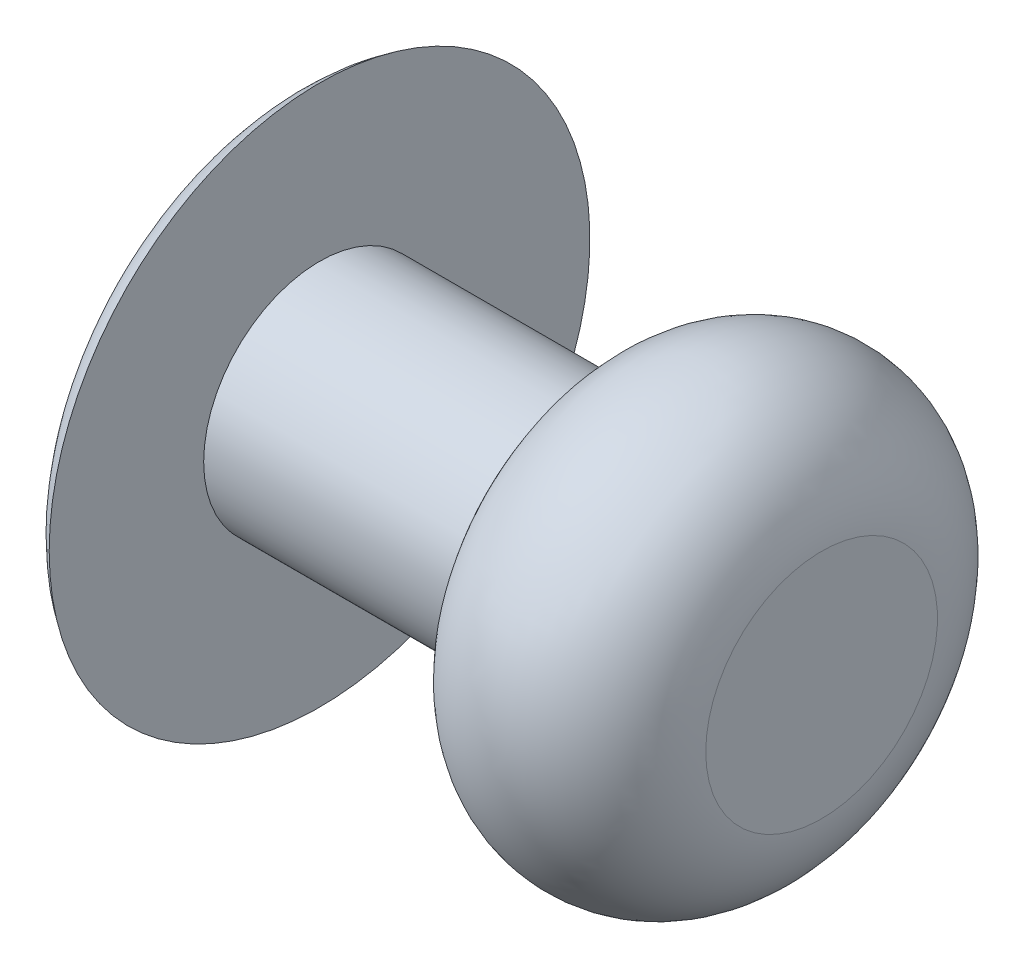
from build123d import *

# Parameters (mm, degrees)
ESQUISSE2_R      = 1
EXTRUSION1_DEPTH = 4


with BuildPart() as part:
    # Esquisse1 → Révolution1 (revolve)
    with BuildSketch(Plane.XY, mode=Mode.PRIVATE) as r_volution1_sk:
        with BuildLine():
            Line((-13.490599357, 0), (-13.490599357, 2.5))
            ThreePointArc((-13.490599357, 2.5), (-13.343527434, 3.071044042), (-12.938906334, 3.5))
            Line((-12.938906334, 3.5), (-12.938906334, 1.5))
            Line((-12.938906334, 1.5), (-9.438906334, 1.5))
            ThreePointArc((-9.438906334, 1.5), (-7.938906334, 2.903329638), (-6.438906334, 1.5))
            Line((-6.438906334, 1.5), (-6.438906334, 0))
            Line((-6.438906334, 0), (-13.490599357, 0))
        make_face()
    revolve(r_volution1_sk.sketch.rotate(Axis((-91.106565723, 0, 0), (1, 0, 0)), 90), axis=Axis((-91.106565723, 0, 0), (1, 0, 0)))

    # Esquisse2 → Extrusion1 (cut)
    with BuildSketch(Plane.ZY.offset(13.490599357)):
        Circle(ESQUISSE2_R)
    extrude(amount=-EXTRUSION1_DEPTH, mode=Mode.SUBTRACT)


solid = part.part
